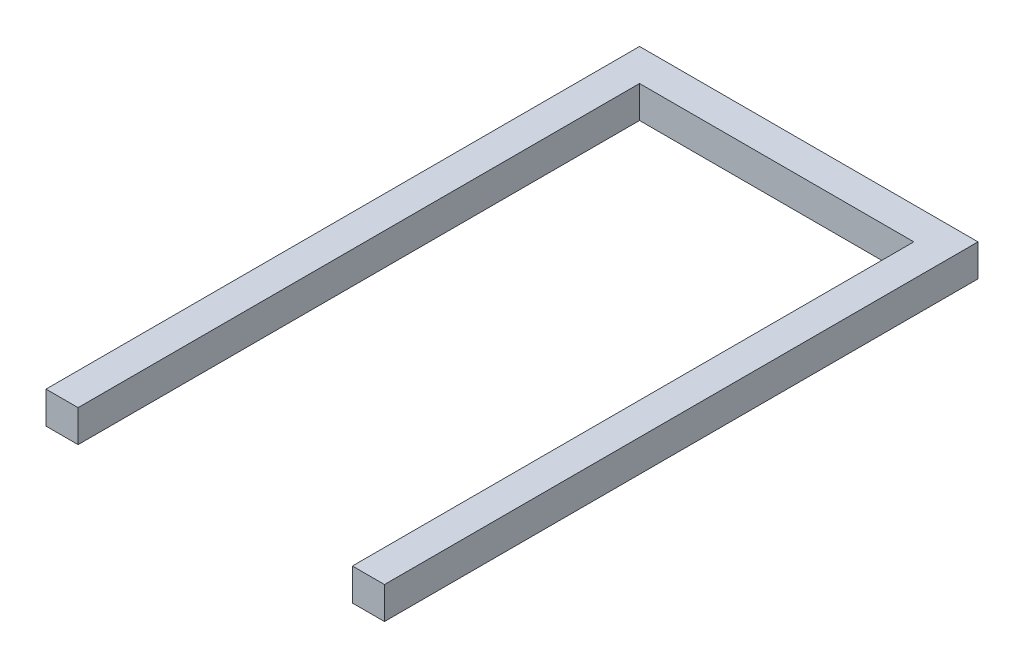
from build123d import *

# Parameters (mm, degrees)
BOSS_EXTRUDE1_DEPTH = 4


with BuildPart() as part:
    # Sketch1 → Boss-Extrude1 (new body)
    with BuildSketch(Plane(origin=(0, 0, 0), x_dir=(1, 0, 0), z_dir=(0, 1, 0))):
        Polygon((-51.181381644, -26.768939394), (-51.181381644, 47.231060606), (-8.981381644, 47.231060606), (-8.981381644, -26.768939394), (-12.981381644, -26.768939394), (-12.981381644, 43.231060606), (-47.181381644, 43.231060606), (-47.181381644, -26.768939394), align=None)
    extrude(amount=BOSS_EXTRUDE1_DEPTH)


solid = part.part
